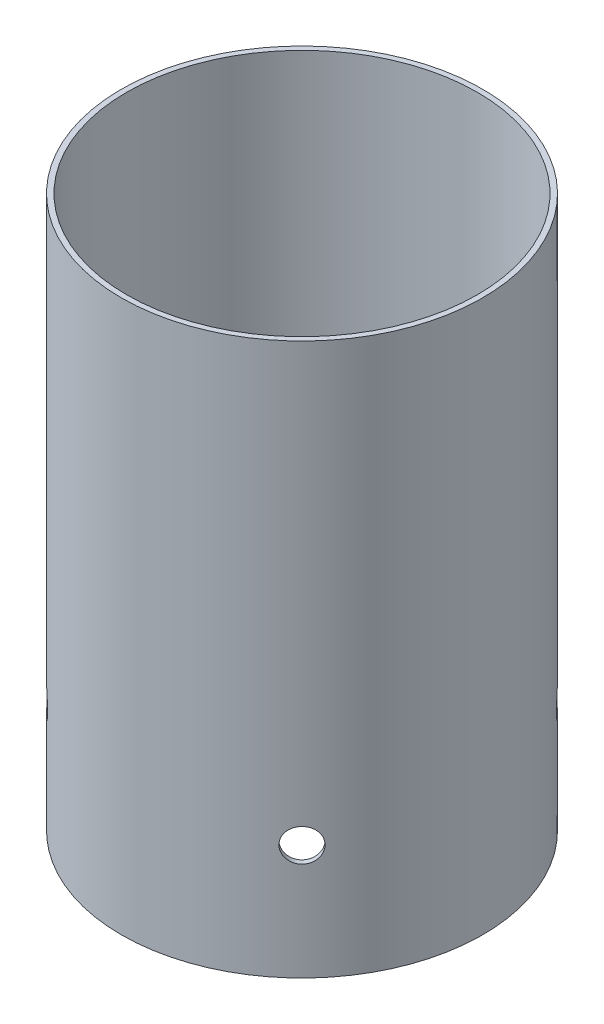
from build123d import *

# Parameters (mm, degrees)
SKETCH1_R               = 39.3
SKETCH1_R_2             = 38.15
BOSS_EXTRUDE1_DEPTH     = 120
CUT_EXTRUDE1_REACH      = 154.977
CUT_EXTRUDE1_END_RADIUS = 38.15
SKETCH2_R               = 3.55
CIRPATTERN1_COUNT       = 4


with BuildPart() as part:
    # Sketch1 → Boss-Extrude1 (new body)
    with BuildSketch(Plane(origin=(0, 0, 0), x_dir=(1, 0, 0), z_dir=(0, 1, 0))):
        with Locations(Location((0, 0, 0), (0, 0, 270))):
            Circle(SKETCH1_R)
        with Locations(Location((0, 0, 0), (0, 0, 270))):
            Circle(SKETCH1_R_2, mode=Mode.SUBTRACT)
    extrude(amount=BOSS_EXTRUDE1_DEPTH)

    # Cut-Extrude1: up to this cylinder (the profile starts outside it)
    cut_extrude1_end = Plane(origin=(0, 25, 0), z_dir=(0, -1, 0)) * Cylinder(CUT_EXTRUDE1_END_RADIUS, 387.254, mode=Mode.PRIVATE)
    # Sketch2 → Cut-Extrude1 (cut, up to the surface)
    with BuildSketch(Plane(origin=(-27.789296501, 0, -27.789296501), x_dir=(0, -1, 0), z_dir=(-0.7071067811865464, 0, -0.7071067811865488)), mode=Mode.PRIVATE) as cut_extrude1_sk1:
        with Locations(Location((-25, 0, 0), (0, 0, 90))):
            Circle(SKETCH2_R)
    cut_extrude1_tool1 = extrude(cut_extrude1_sk1.sketch, amount=-CUT_EXTRUDE1_REACH, mode=Mode.PRIVATE) - cut_extrude1_end
    cut_extrude1 = cut_extrude1_tool1.solids().sort_by_distance((-27.789297, 25, -27.789297))[0]
    add(cut_extrude1, mode=Mode.SUBTRACT)

    # CirPattern1: Cut-Extrude1 ×4 about axis
    cirpattern1_axis = Axis((0, 120, 0), (0, -1, 0))
    for i in range(1, CIRPATTERN1_COUNT):
        add(cut_extrude1.rotate(cirpattern1_axis, i * 360 / CIRPATTERN1_COUNT), mode=Mode.SUBTRACT)


solid = part.part
